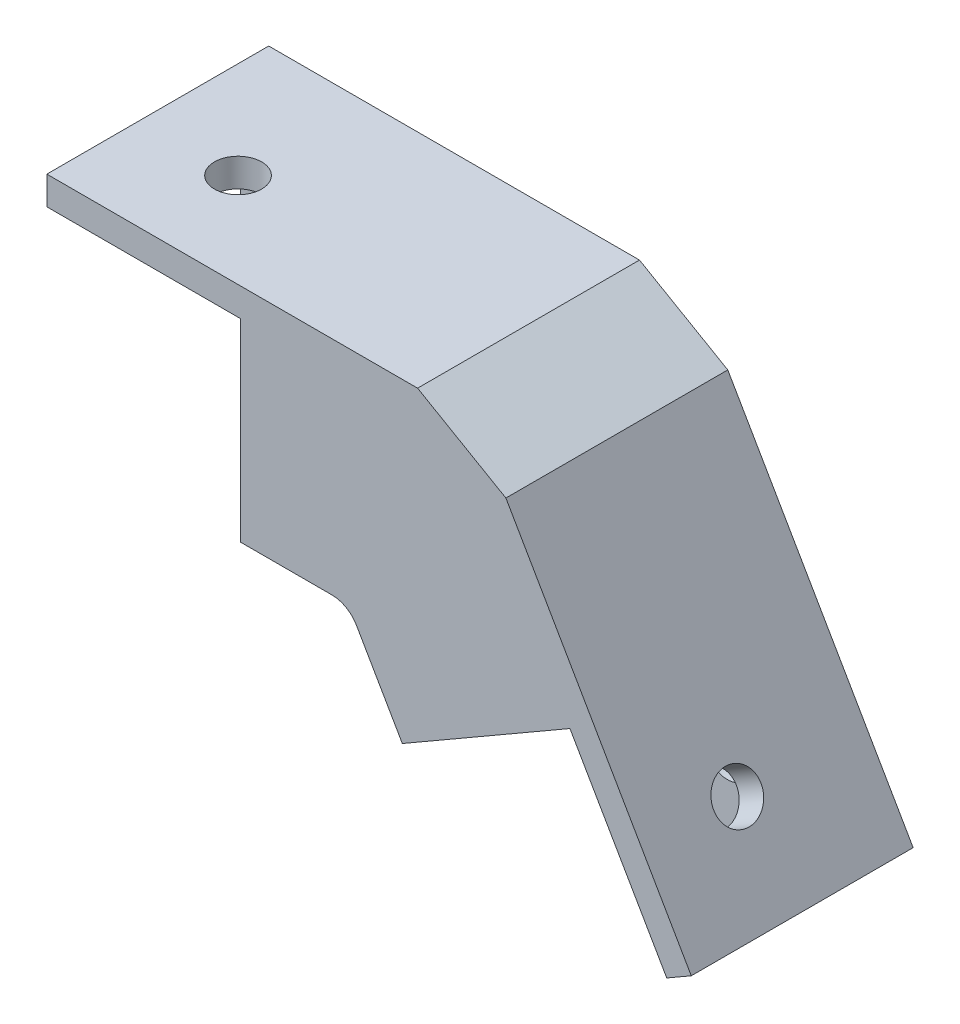
from build123d import *

# Parameters (mm, degrees)
BOSS_EXTRUDE1_DEPTH   = 23.5
BOSS_EXTRUDE2_DEPTH   = 3
SKETCH2_W             = 20.5
SKETCH2_H             = 20.5
BOSS_EXTRUDE2_2_DEPTH = 3
SKETCH5_W             = 20.5
SKETCH5_H             = 3
BOSS_EXTRUDE4_DEPTH   = 23.5
FILLET5_R             = 3
CUT_EXTRUDE5_DEPTH    = 60.975535321
SKETCH16_R            = 2.5
CUT_EXTRUDE7_DEPTH    = 40
SKETCH17_R            = 2.5
CUT_EXTRUDE8_DEPTH    = 68.687454275
SKETCH23_R            = 2.5
CUT_EXTRUDE14_DEPTH   = 59.864801342


with BuildPart() as part:
    # Sketch1 → Boss-Extrude1 (new body)
    with BuildSketch(Plane.XY):
        Polygon((0, 0), (0, 23.5), (25, 23.5), (37.5, 1.849364905), (17.148403011, -9.900635095), (11.432268674, 0), align=None)
    extrude(amount=BOSS_EXTRUDE1_DEPTH)



with BuildPart() as body_2:
    # Sketch2 → Boss-Extrude2 (new body)
    with BuildSketch(Plane.XY):
        Polygon((17.148403011, -9.900635095), (34.901923789, 0.349364905), (45.151923789, -17.404155872), (27.398403011, -27.654155872), align=None)
    extrude(amount=BOSS_EXTRUDE2_DEPTH)


with BuildPart() as body_3:
    # Sketch2 → Boss-Extrude2 2 (new body)
    with BuildSketch(Plane.XY):
        with Locations((-10.25, 10.25)):
            Rectangle(SKETCH2_W, SKETCH2_H)
    extrude(amount=BOSS_EXTRUDE2_2_DEPTH)


with BuildPart() as part_1:
    add(part.part)

    add(body_2.part)  # Boss-Extrude4 merges body 2

    add(body_3.part)  # Boss-Extrude4 merges body 3
    # Sketch5 → Boss-Extrude4 (add)
    with BuildSketch(Plane.XY.offset(23.5)):
        with Locations((-10.25, 22)):
            Rectangle(SKETCH5_W, SKETCH5_H)
        Polygon((34.901923789, 0.349364905), (37.5, 1.849364905), (47.75, -15.904155872), (45.151923789, -17.404155872), align=None)
    extrude(amount=-BOSS_EXTRUDE4_DEPTH)

    # Fillet5
    fillet5_edges = [part_1.edges().sort_by_distance(p)[0] for p in [
        (11.432268674, 0, 11.75),
    ]]
    fillet(fillet5_edges, radius=FILLET5_R)

    # Sketch14 → Cut-Extrude5 (cut, through all)
    with BuildSketch(Plane.XY.offset(23.5)):
        Polygon((18.765371804, 23.5), (28.117314098, 18.100653599), (30.117314098, 21.564755215), (20.765371804, 26.964101615), align=None)
    extrude(amount=-CUT_EXTRUDE5_DEPTH, mode=Mode.SUBTRACT)

    # Sketch16 → Cut-Extrude7 (cut)
    with BuildSketch(Plane.XZ.offset(-20.5)):
        with Locations((-10.25, 13.5)):
            Circle(SKETCH16_R)
    extrude(amount=-CUT_EXTRUDE7_DEPTH, mode=Mode.SUBTRACT)

    # Sketch17 → Cut-Extrude8 (cut, through all)
    with BuildSketch(Plane(origin=(26.327722283, 15.200317547, 0), x_dir=(0, 0, 1), z_dir=(-0.8660254037844385, -0.5000000000000003, 0))):
        with Locations(Location((13.5, -27.398403011, 0), (0, 0, 270))):
            Circle(SKETCH17_R)
    extrude(amount=-CUT_EXTRUDE8_DEPTH, mode=Mode.SUBTRACT)

    # Sketch23 → Cut-Extrude14 (cut, through all)
    with BuildSketch(Plane.XY.offset(3)):
        with Locations((-10.5, 10)):
            Circle(SKETCH23_R)
        with Locations((31.058657049, -13.993901834)):
            Circle(SKETCH23_R)
    extrude(amount=-CUT_EXTRUDE14_DEPTH, mode=Mode.SUBTRACT)


solid = part_1.part
